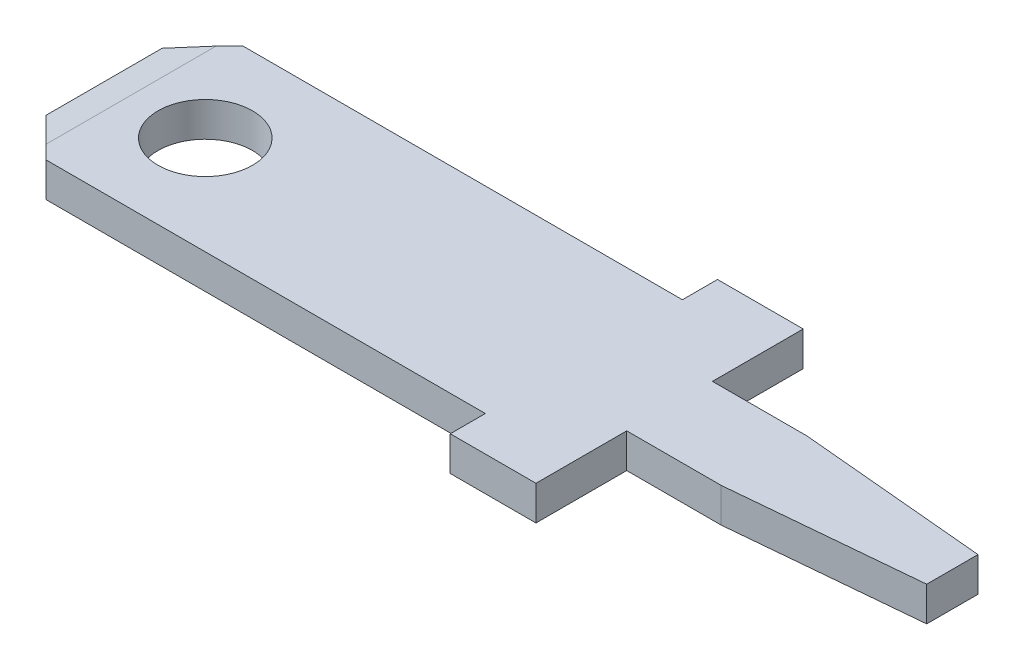
from build123d import *
from OCP.BRepFilletAPI import BRepFilletAPI_MakeChamfer

# Parameters (mm, degrees)
BOSS_EXTRUDE1_DEPTH = 0.255
SKETCH2_R           = 0.7
CUT_EXTRUDE1_DEPTH  = 9.625827497
CHAMFER1_SIZE       = 0.4
CHAMFER1_SIZE2      = 0.027970725


with BuildPart() as part:
    # Sketch1 → Boss-Extrude1 (new, symmetric)
    with BuildSketch(Plane(origin=(0, 0, 0), x_dir=(1, 0, 0), z_dir=(0, 1, 0))):
        Polygon((0, 1.98), (-1.27, 1.98), (-1.27, 1.46), (-7.78, 1.46), (-8.38, 0.86), (-8.38, 0), (4.19, 0), (4.19, 0.38), (1.4, 0.635), (0, 0.635), align=None)
    boss_extrude1 = extrude(amount=BOSS_EXTRUDE1_DEPTH, both=True)

    # Mirror1: Boss-Extrude1 across plane
    add(boss_extrude1.mirror(Plane(origin=(-8.38, 0.255, 0), x_dir=(1, 0, 0), z_dir=(0, 0, -1))))

    # Sketch2 → Cut-Extrude1 (cut, through all)
    with BuildSketch(Plane(origin=(0, 0.255, 0), x_dir=(1, 0, 0), z_dir=(0, 1, 0))):
        with Locations((-6.88, 0)):
            Circle(SKETCH2_R)
    extrude(amount=-CUT_EXTRUDE1_DEPTH, mode=Mode.SUBTRACT)

    # Chamfer1: one chamfer whose edges measure the first distance from different faces: ONE call of the kernel's chamfer builder (chamfer() names one face for all edges)
    chamfer1_edges_1 = [part.edges().sort_by_distance(p)[0] for p in [
        (-8.38, -0.255, 0),
    ]]
    chamfer1_side_1 = [part.faces().sort_by_distance(p)[0] for p in [
        (-2.842081645, -0.255, 0),
    ]]
    chamfer1_edges_2 = [part.edges().sort_by_distance(p)[0] for p in [
        (-8.38, 0.255, 0),
    ]]
    chamfer1_side_2 = [part.faces().sort_by_distance(p)[0] for p in [
        (-2.842081645, 0.255, 0),
    ]]
    chamfer1 = BRepFilletAPI_MakeChamfer(part.part.solid().wrapped)
    for e in chamfer1_edges_1:
        chamfer1.Add(CHAMFER1_SIZE, CHAMFER1_SIZE2, e.wrapped, chamfer1_side_1[0].wrapped)  # the first distance lies on this face
    for e in chamfer1_edges_2:
        chamfer1.Add(CHAMFER1_SIZE, CHAMFER1_SIZE2, e.wrapped, chamfer1_side_2[0].wrapped)  # the first distance lies on this face
    add(Compound.cast(chamfer1.Shape()), mode=Mode.REPLACE)


solid = part.part
